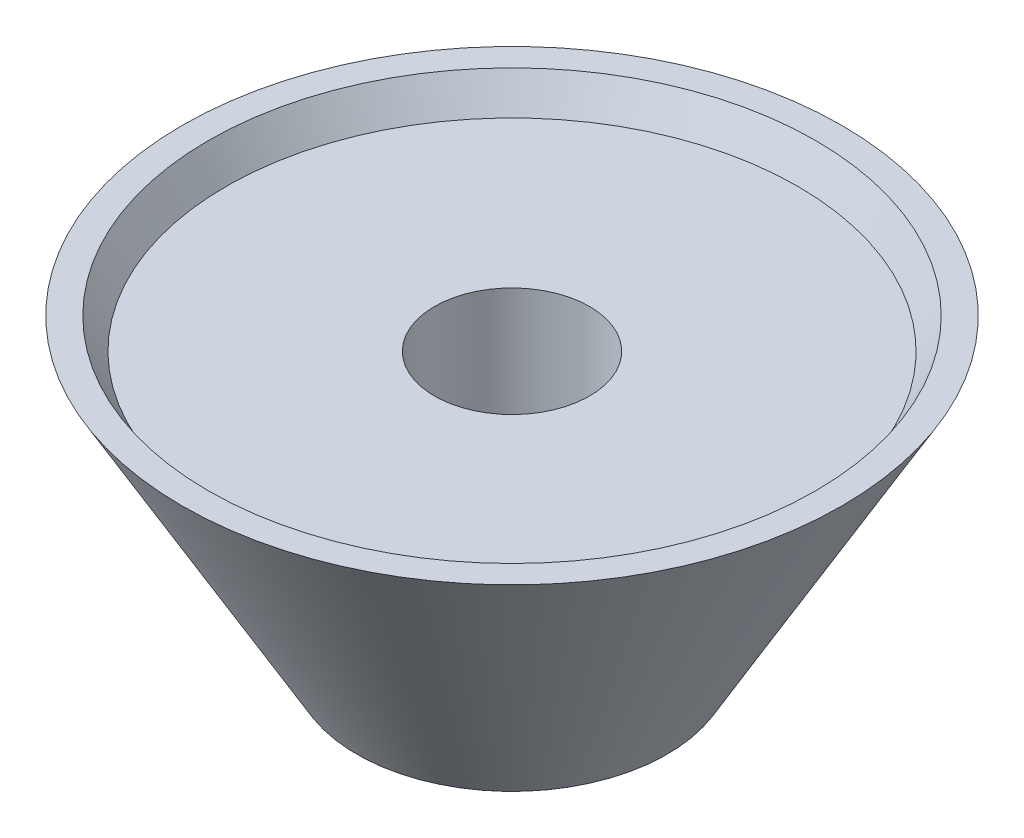
from build123d import *


with BuildPart() as part:
    # Sketch1 → Revolve2 (revolve)
    with BuildSketch(Plane(origin=(0, 0, 0), x_dir=(0, 0, -1), z_dir=(1, 0, 0))):
        Polygon((-4.5, 7.794228634), (0, 0), (2, 0), (2, 7), (-3.366397964, 7), (-3.82494608, 7.794228634), align=None)
        Polygon((1, 1.4), (0, 1.4), (-2.886751346, 6.4), (1, 6.4), align=None, mode=Mode.SUBTRACT)
    revolve(axis=Axis((0, 0, -4), (0, 1, 0)))


solid = part.part
